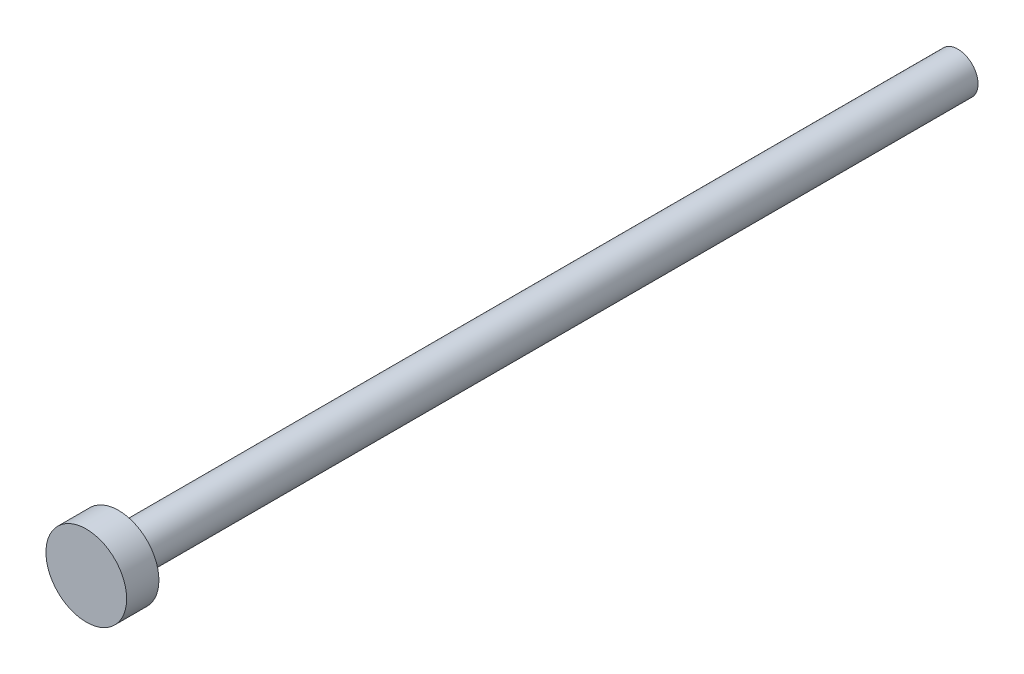
from build123d import *

# Parameters (mm, degrees)
SKETCH1_R           = 1.25
BOSS_EXTRUDE1_DEPTH = 1
SKETCH2_R           = 0.625
BOSS_EXTRUDE2_DEPTH = 26


with BuildPart() as part:
    # Sketch1 → Boss-Extrude1 (new body)
    with BuildSketch(Plane.XY):
        Circle(SKETCH1_R)
    extrude(amount=BOSS_EXTRUDE1_DEPTH)

    # Sketch2 → Boss-Extrude2 (add)
    with BuildSketch(Plane(origin=(0, 0, 0), x_dir=(-1, 0, 0), z_dir=(0, 0, -1))):
        Circle(SKETCH2_R)
    extrude(amount=BOSS_EXTRUDE2_DEPTH)


solid = part.part
